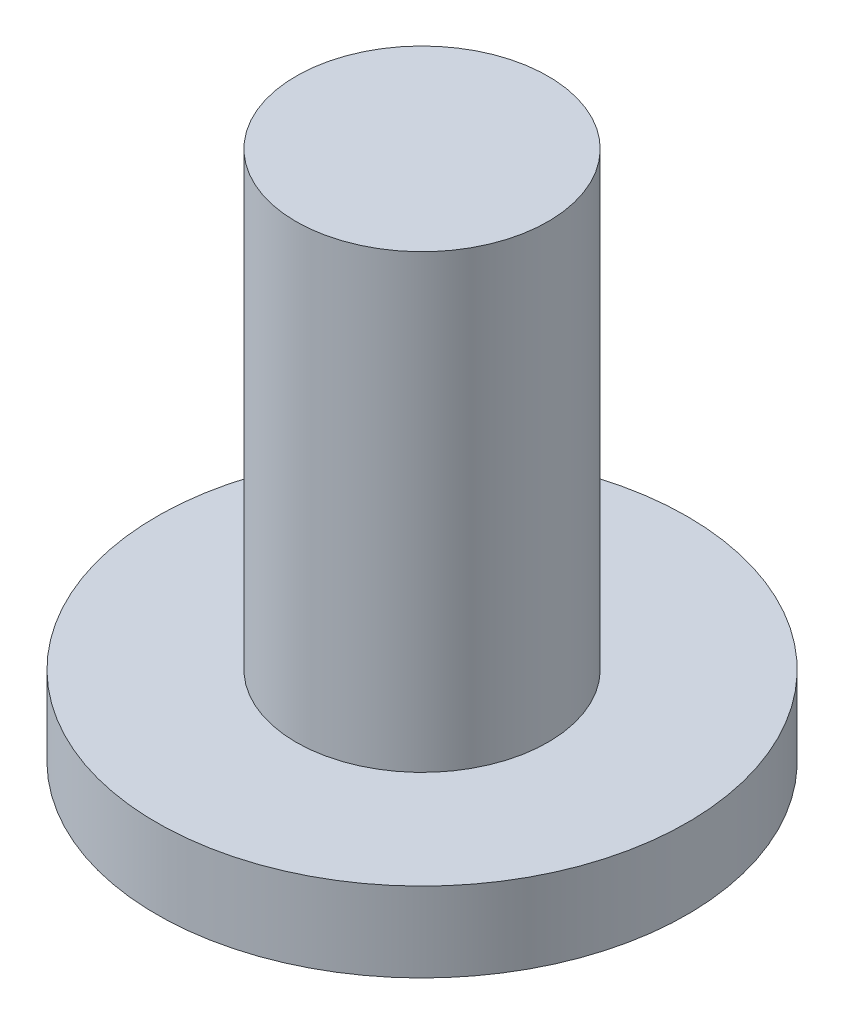
from build123d import *

# Parameters (mm, degrees)
SKETCH_1_R      = 4.75
EXTRUDE_1_DEPTH = 17
SKETCH_2_R      = 10
EXTRUDE_2_DEPTH = 3


with BuildPart() as part:
    # 草图1 → 凸台-拉伸1 (new body)
    with BuildSketch(Plane(origin=(0, 0, 0), x_dir=(1, 0, 0), z_dir=(0, 1, 0))):
        with Locations(Location((0, 0, 0), (0, 0, 270))):
            Circle(SKETCH_1_R)
    extrude(amount=EXTRUDE_1_DEPTH)

    # 草图2 → 凸台-拉伸2 (add)
    with BuildSketch(Plane.XZ):
        with Locations(Location((0, 0, 0), (0, 0, 270))):
            Circle(SKETCH_2_R)
    extrude(amount=EXTRUDE_2_DEPTH)


solid = part.part
